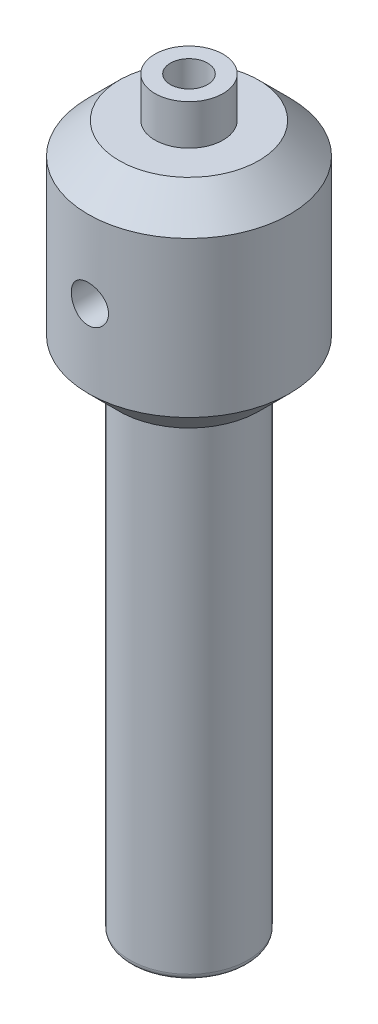
from build123d import *

# Parameters (mm, degrees)
CHAMFER1_SIZE           = 10
FILLET1_R               = 2
HOLE1_D                 = 12
HOLE1_DEPTH             = 23
CUT_EXTRUDE1_DEPTH      = 245.361412666
CUT_EXTRUDE1_DEPTH_BACK = 245.361412666
SKETCH4_R               = 6


with BuildPart() as part:
    # Sketch1 → Revolve1 (revolve)
    with BuildSketch(Plane.XY, mode=Mode.PRIVATE) as revolve1_sk:
        Polygon((0, 0), (0, 240), (11, 240), (11, 227), (32.5, 227), (32.5, 157), (19, 157), (19, 0), align=None)
    revolve(revolve1_sk.sketch.rotate(Axis((0, 0, 0), (0, 1, 0)), 90), axis=Axis((0, 0, 0), (0, 1, 0)))

    # Chamfer1
    chamfer1_edges = [part.edges().sort_by_distance(p)[0] for p in [
        (0, 157, 32.5),
        (0, 227, 32.5),
    ]]
    chamfer(chamfer1_edges, length=CHAMFER1_SIZE)

    # Fillet1
    fillet1_edges = [part.edges().sort_by_distance(p)[0] for p in [
        (0, 0, 19),
    ]]
    fillet(fillet1_edges, radius=FILLET1_R)

    # Hole1
    with Locations(Plane(origin=(0, 240, 0), x_dir=(1, 0, 0), z_dir=(0, 1, 0))):
        with Locations((0, 0)):
            Hole(HOLE1_D / 2, depth=HOLE1_DEPTH)

    # Sketch4 → Cut-Extrude1 (cut, two sides: drawn at the far end of the back side and taken through both)
    with BuildSketch(Plane.XY.offset(-CUT_EXTRUDE1_DEPTH_BACK)):
        with Locations((0, 192)):
            Circle(SKETCH4_R)
    extrude(amount=CUT_EXTRUDE1_DEPTH + CUT_EXTRUDE1_DEPTH_BACK, mode=Mode.SUBTRACT)


solid = part.part
